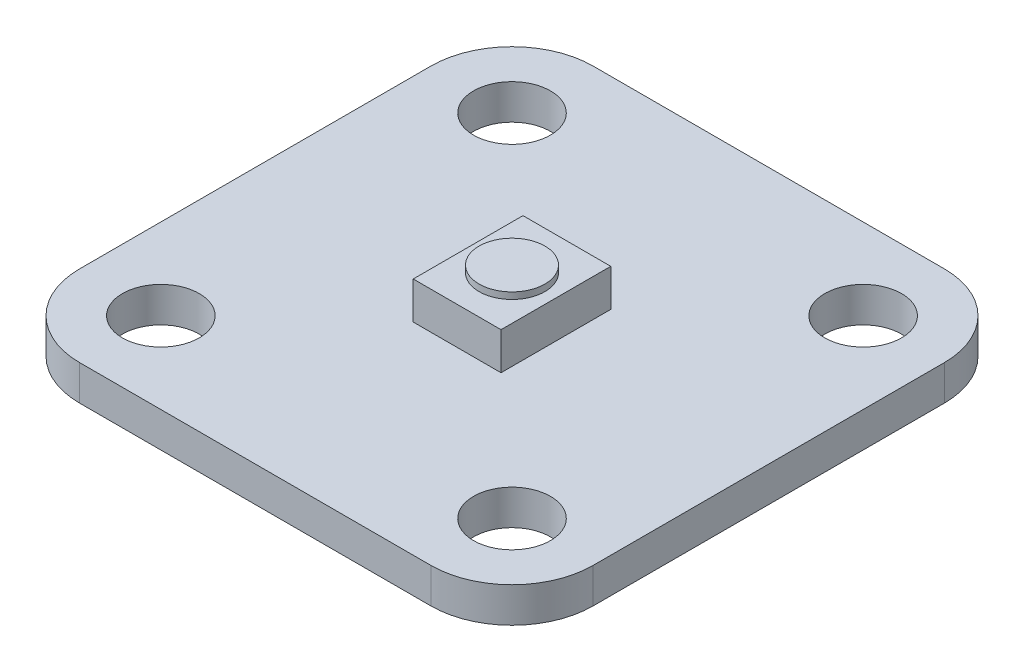
from build123d import *

# Parameters (mm, degrees)
SKETCH1_R           = 1.75
BOSS_EXTRUDE1_DEPTH = 1.6
SKETCH2_W           = 2
SKETCH2_H           = 5
BOSS_EXTRUDE2_DEPTH = 1.7
SKETCH3_R           = 1.5
BOSS_EXTRUDE3_DEPTH = 0.3


with BuildPart() as part:
    # Sketch1 → Boss-Extrude1 (new body)
    with BuildSketch(Plane(origin=(0, 0, 0), x_dir=(1, 0, 0), z_dir=(0, 1, 0))):
        with BuildLine():
            Line((3.7, 0), (19.7, 0))
            ThreePointArc((19.7, 0), (22.31629509, 1.08370491), (23.4, 3.7))
            Line((23.4, 3.7), (23.4, 19.7))
            ThreePointArc((23.4, 19.7), (22.31629509, 22.31629509), (19.7, 23.4))
            Line((19.7, 23.4), (3.7, 23.4))
            ThreePointArc((3.7, 23.4), (1.08370491, 22.31629509), (0, 19.7))
            Line((0, 19.7), (0, 3.7))
            ThreePointArc((0, 3.7), (1.08370491, 1.08370491), (3.7, 0))
        make_face()
        with Locations(Location((3.7, 19.7, 0), (0, 0, 270))):
            Circle(SKETCH1_R, mode=Mode.SUBTRACT)
        with Locations(Location((19.7, 19.7, 0), (0, 0, 270))):
            Circle(SKETCH1_R, mode=Mode.SUBTRACT)
        with Locations(Location((19.7, 3.7, 0), (0, 0, 270))):
            Circle(SKETCH1_R, mode=Mode.SUBTRACT)
        with Locations(Location((3.7, 3.7, 0), (0, 0, 270))):
            Circle(SKETCH1_R, mode=Mode.SUBTRACT)
    extrude(amount=BOSS_EXTRUDE1_DEPTH)

    # Sketch2 → Boss-Extrude2 (add)
    with BuildSketch(Plane(origin=(0, 1.6, 0), x_dir=(1, 0, 0), z_dir=(0, 1, 0))):
        with Locations((12.7, 11.7)):
            Rectangle(SKETCH2_W, SKETCH2_H)
        with Locations((10.7, 11.7)):
            Rectangle(SKETCH2_W, SKETCH2_H)
    extrude(amount=BOSS_EXTRUDE2_DEPTH)

    # Sketch3 → Boss-Extrude3 (add)
    with BuildSketch(Plane(origin=(0, 3.3, 0), x_dir=(1, 0, 0), z_dir=(0, 1, 0))):
        with Locations(Location((11.7, 11.7, 0), (0, 0, 270))):
            Circle(SKETCH3_R)
    extrude(amount=BOSS_EXTRUDE3_DEPTH)


solid = part.part
